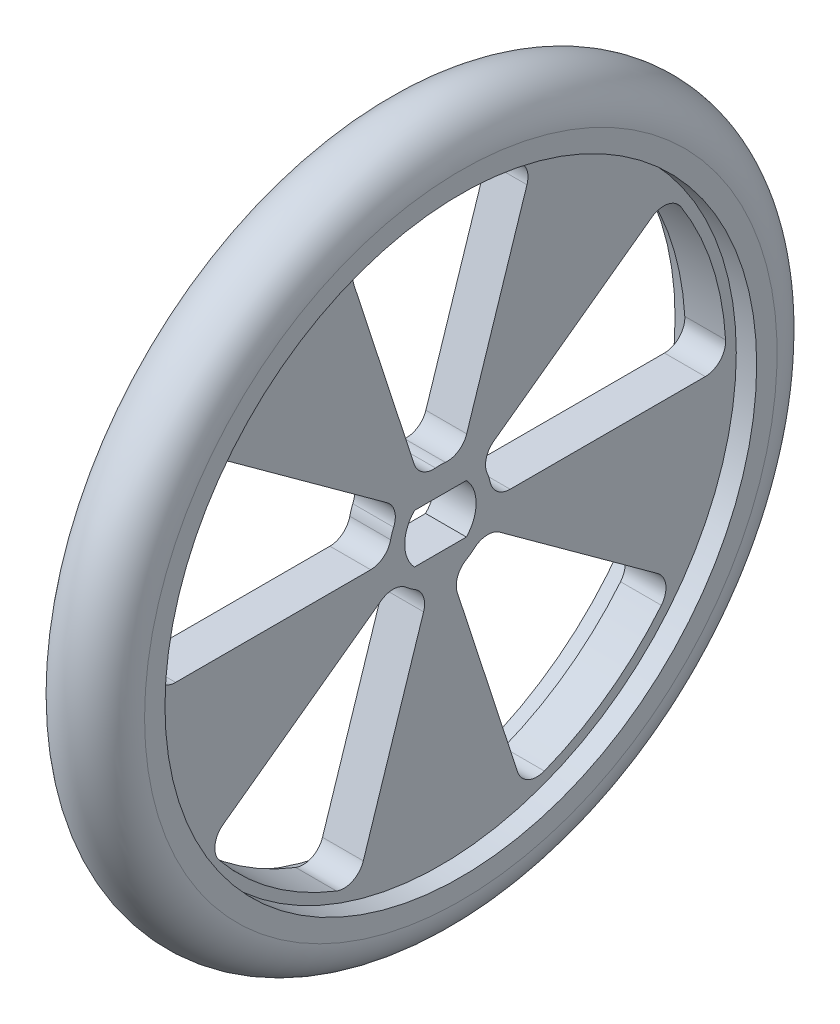
from build123d import *

# Parameters (mm, degrees)
SKETCH1_R                = 31
BOSS_EXTRUDE1_DEPTH      = 8
SKETCH3_R                = 29
CUT_EXTRUDE1_DEPTH       = 2
CUT_EXTRUDE2_DEPTH       = 45.24929378
FILLET2_R                = 2
CIRPATTERN1_COUNT        = 5
FILLET2_OF_CIRPATTERN1_R = 2
CUT_EXTRUDE3_REACH       = 46.249


with BuildPart() as part:
    # Sketch1 → Boss-Extrude1 (new body)
    with BuildSketch(Plane(origin=(0, 0, 0), x_dir=(0, 0, -1), z_dir=(1, 0, 0))):
        Circle(SKETCH1_R)
    extrude(amount=BOSS_EXTRUDE1_DEPTH)

    # Sketch3 → Cut-Extrude1 (cut)
    with BuildSketch(Plane(origin=(8, 0, 0), x_dir=(0, 0, -1), z_dir=(1, 0, 0))):
        Circle(SKETCH3_R)
    cut_extrude1 = extrude(amount=-CUT_EXTRUDE1_DEPTH, mode=Mode.SUBTRACT)

    # Sketch4 → Cut-Extrude2 (cut, through all)
    with BuildSketch(Plane(origin=(6, 0, 0), x_dir=(0, 0, -1), z_dir=(1, 0, 0))):
        with BuildLine():
            Line((-2, 4.582575695), (-9.113404062, 26.475382271))
            ThreePointArc((-9.113404062, 26.475382271), (0, 28), (9.113404062, 26.475382271))
            Line((9.113404062, 26.475382271), (2, 4.582575695))
            ThreePointArc((2, 4.582575695), (0, 5), (-2, 4.582575695))
        make_face()
    cut_extrude2 = extrude(amount=-CUT_EXTRUDE2_DEPTH, mode=Mode.SUBTRACT)

    # Fillet2
    fillet2_edges = [part.edges().sort_by_distance(p)[0] for p in [
        (3, 4.582575695, -2),
        (3, 4.582575695, 2),
        (3, 26.475382271, 9.113404062),
        (3, 26.475382271, -9.113404062),
    ]]
    fillet(fillet2_edges, radius=FILLET2_R)

    # CirPattern1: Cut-Extrude2 ×5 about axis
    cirpattern1_axis = Axis((0, 0, 0), (1, 0, 0))
    for i in range(1, CIRPATTERN1_COUNT):
        add(cut_extrude2.rotate(cirpattern1_axis, i * 360 / CIRPATTERN1_COUNT), mode=Mode.SUBTRACT)

    # Fillet2 of CirPattern1
    fillet2_of_cirpattern1_edges = [part.edges().sort_by_distance(p)[0] for p in [
        (3, 3.3182068, 3.740254487),
        (3, -0.486019265, 4.976322465),
        (3, -0.486019265, 27.995781562),
        (3, 16.848705373, 22.363388098),
        (3, -2.531811111, 4.3116044),
        (3, -4.88295212, 1.075536422),
        (3, -26.775758696, 8.188940485),
        (3, -16.062309684, 22.934738011),
        (3, -4.88295212, -1.075536422),
        (3, -2.531811111, -4.3116044),
        (3, -16.062309684, -22.934738011),
        (3, -26.775758696, -8.188940485),
        (3, -0.486019265, -4.976322465),
        (3, 3.3182068, -3.740254487),
        (3, 16.848705373, -22.363388098),
        (3, -0.486019265, -27.995781562),
    ]]
    fillet(fillet2_of_cirpattern1_edges, radius=FILLET2_OF_CIRPATTERN1_R)

    # Mirror1: Cut-Extrude1 across plane
    add(cut_extrude1.mirror(Plane(origin=(4, 0, 0), x_dir=(0, 0, 1), z_dir=(1, 0, 0))), mode=Mode.SUBTRACT)

    # Sketch5 → Cut-Extrude3 (cut, up to next)
    with BuildSketch(Plane(origin=(6, 0, 0), x_dir=(0, 0, -1), z_dir=(1, 0, 0)), mode=Mode.PRIVATE) as cut_extrude3_sk1:
        with BuildLine():
            Line((-2.547547841, 2.4), (2.547547841, 2.4))
            ThreePointArc((2.547547841, 2.4), (3.5, 0), (2.547547841, -2.4))
            Line((2.547547841, -2.4), (-2.547547841, -2.4))
            ThreePointArc((-2.547547841, -2.4), (-3.5, 0), (-2.547547841, 2.4))
        make_face()
    cut_extrude3_tool1 = extrude(cut_extrude3_sk1.sketch, amount=-CUT_EXTRUDE3_REACH, mode=Mode.PRIVATE) & part.part
    add(cut_extrude3_tool1.solids().sort_by_distance((6, 0, 0))[0], mode=Mode.SUBTRACT)

    # Sketch6 → Revolve1 (revolve)
    with BuildSketch(Plane.XY, mode=Mode.PRIVATE) as revolve1_sk:
        with BuildLine():
            Line((0, 31), (8, 31))
            ThreePointArc((8, 31), (4, 35), (0, 31))
        make_face()
    revolve(revolve1_sk.sketch.rotate(Axis((-0.381, 0, 0), (1, 0, 0)), 90), axis=Axis((-0.381, 0, 0), (1, 0, 0)))


solid = part.part
